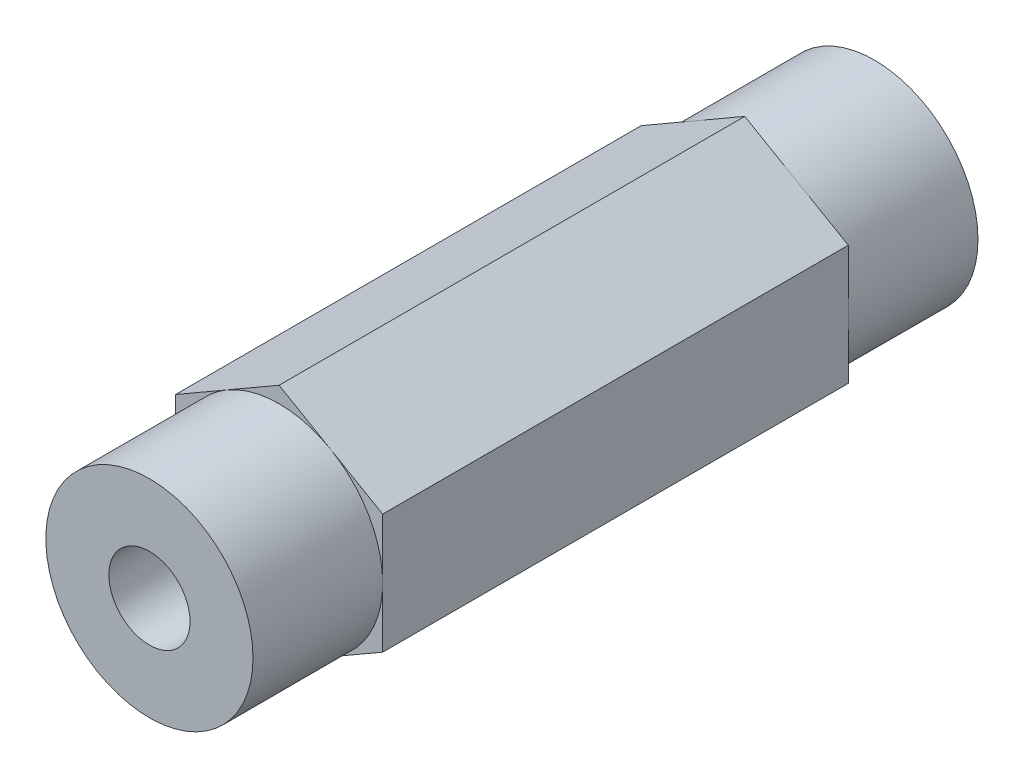
from build123d import *

# Parameters (mm, degrees)
BOSS_EXTRUDE1_DEPTH = 14.2748
SKETCH2_R           = 6.35
SKETCH2_R_2         = 2.4892
BOSS_EXTRUDE2_DEPTH = 7.9502


with BuildPart() as part:
    # Sketch1 → Boss-Extrude1 (new, symmetric)
    with BuildSketch(Plane.XY):
        Polygon((0, 7.332348419), (-6.35, 3.666174209), (-6.35, -3.666174209), (0, -7.332348419), (6.35, -3.666174209), (6.35, 3.666174209), align=None)
    extrude(amount=BOSS_EXTRUDE1_DEPTH, both=True)

    # Sketch2 → Boss-Extrude2 (add)
    with BuildSketch(Plane.XY.offset(14.2748)):
        Circle(SKETCH2_R)
        Circle(SKETCH2_R_2, mode=Mode.SUBTRACT)
    boss_extrude2 = extrude(amount=BOSS_EXTRUDE2_DEPTH)

    # Mirror1: Boss-Extrude2 across plane
    add(boss_extrude2.mirror(Plane.XY))


solid = part.part
